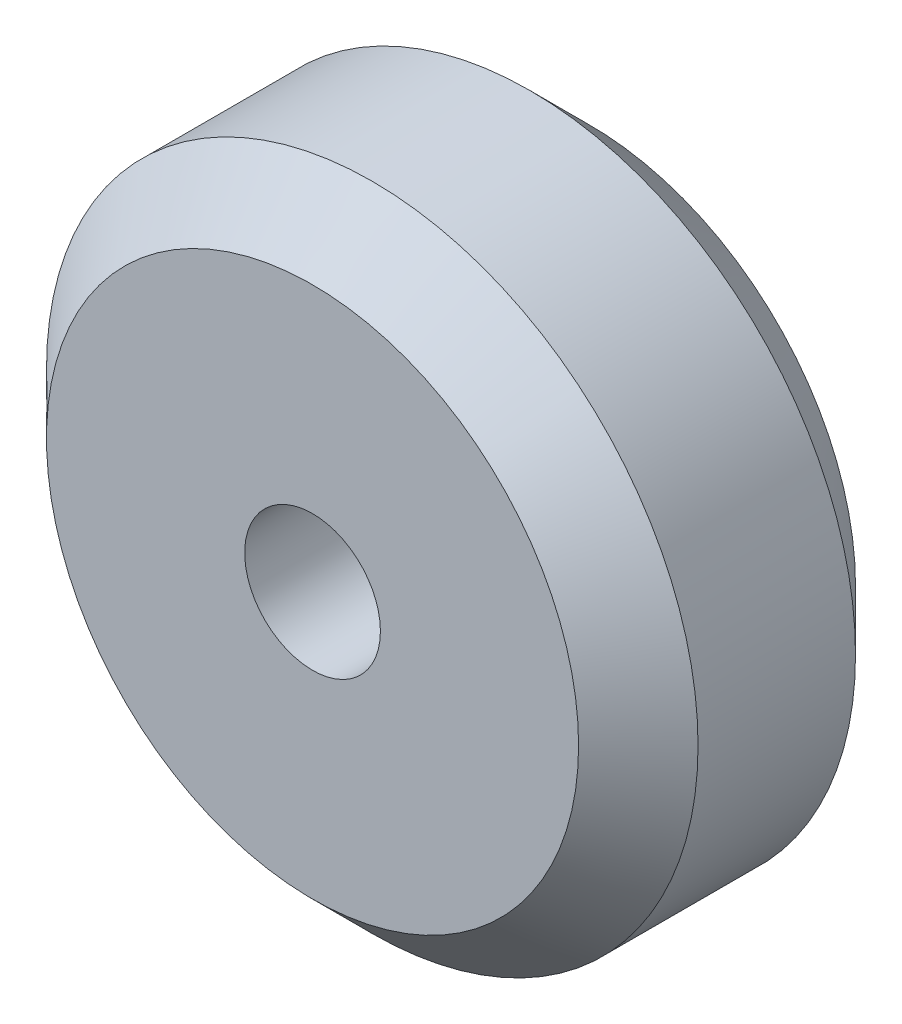
from build123d import *

# Parameters (mm, degrees)
SKETCH_1_R      = 12
SKETCH_1_R_2    = 2.5
EXTRUDE_1_DEPTH = 10.2
CHAMFER_1_SIZE  = 2.2


with BuildPart() as part:
    # 草图1 → 凸台-拉伸1 (new body)
    with BuildSketch(Plane.XY):
        with Locations((19.85, -19.85)):
            Circle(SKETCH_1_R)
        with Locations((19.85, -19.85)):
            Circle(SKETCH_1_R_2, mode=Mode.SUBTRACT)
    extrude(amount=EXTRUDE_1_DEPTH)

    # 倒角1
    chamfer_1_edges = [part.edges().sort_by_distance(p)[0] for p in [
        (7.85, -19.85, 0),
        (7.85, -19.85, 10.2),
    ]]
    chamfer(chamfer_1_edges, length=CHAMFER_1_SIZE)


solid = part.part
